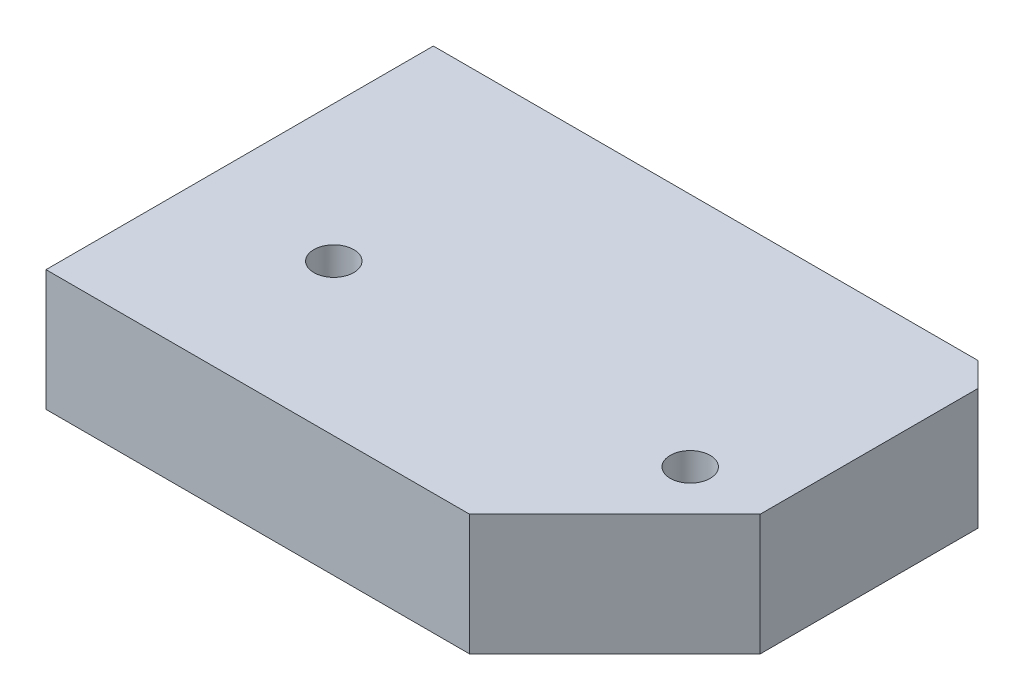
from build123d import *

# Parameters (mm, degrees)
SKETCH_1_W             = 42
SKETCH_1_H             = 10
EXTRUDE_1_DEPTH        = 23.5
CUT_EXTRUDE_1_DEPTH    = 52.720402164
HOLE_WIZARD_M4_2_D     = 3.3
HOLE_WIZARD_M4_2_DEPTH = 10.1
HOLE_WIZARD_M4_2_TIP   = 0.991420021
HOLE_WIZARD_M4_1_D     = 3.3
CHAMFER_4_SIZE         = 12
CUT_EXTRUDE_3_DEPTH    = 34.064331336


with BuildPart() as part:
    # 草图1 → 凸台-拉伸1 (new, symmetric)
    with BuildSketch(Plane(origin=(0, 0, 0), x_dir=(0, 0, -1), z_dir=(1, 0, 0))):
        Rectangle(SKETCH_1_W, SKETCH_1_H)
    extrude(amount=EXTRUDE_1_DEPTH, both=True)

    # 草图2 → 切除-拉伸1 (cut, through all)
    with BuildSketch(Plane(origin=(23.5, 0, 0), x_dir=(0, 0, -1), z_dir=(1, 0, 0))):
        Polygon((21, -5), (11, 5), (21, 5), align=None)
    extrude(amount=-CUT_EXTRUDE_1_DEPTH, mode=Mode.SUBTRACT)

    # M4 螺纹孔2
    with Locations(Plane(origin=(-23.5, -27.863076326, 2.458563873), x_dir=(0, -1, 0), z_dir=(-1, 0, 0))):
        with Locations((-27.863076326, 5.541436127), (-27.863076326, -6.458563873)):
            Hole(HOLE_WIZARD_M4_2_D / 2, depth=HOLE_WIZARD_M4_2_DEPTH)
            with Locations((0, 0, -(HOLE_WIZARD_M4_2_DEPTH + HOLE_WIZARD_M4_2_TIP / 2))):  # 118° drill point
                Cone(0, HOLE_WIZARD_M4_2_D / 2, HOLE_WIZARD_M4_2_TIP, mode=Mode.SUBTRACT)

    # M4 螺纹孔1 (through all)
    with Locations(Plane(origin=(0, -5, 0), x_dir=(-1, 0, 0), z_dir=(0, -1, 0))):
        with Locations((-2.5, 17), (-17.222431864, -8.5), (12.222431864, -8.5)):
            Hole(HOLE_WIZARD_M4_1_D / 2)

    # 倒角4
    chamfer_4_edges = [part.edges().sort_by_distance(p)[0] for p in [
        (23.5, 0, 21),
    ]]
    chamfer(chamfer_4_edges, length=CHAMFER_4_SIZE)

    # 草图8 → 切除-拉伸3 (cut, through all)
    with BuildSketch(Plane.XZ.offset(5)):
        Polygon((23.5, -9), (11.5, -21), (23.5, -21), align=None)
    extrude(amount=-CUT_EXTRUDE_3_DEPTH, mode=Mode.SUBTRACT)


solid = part.part
